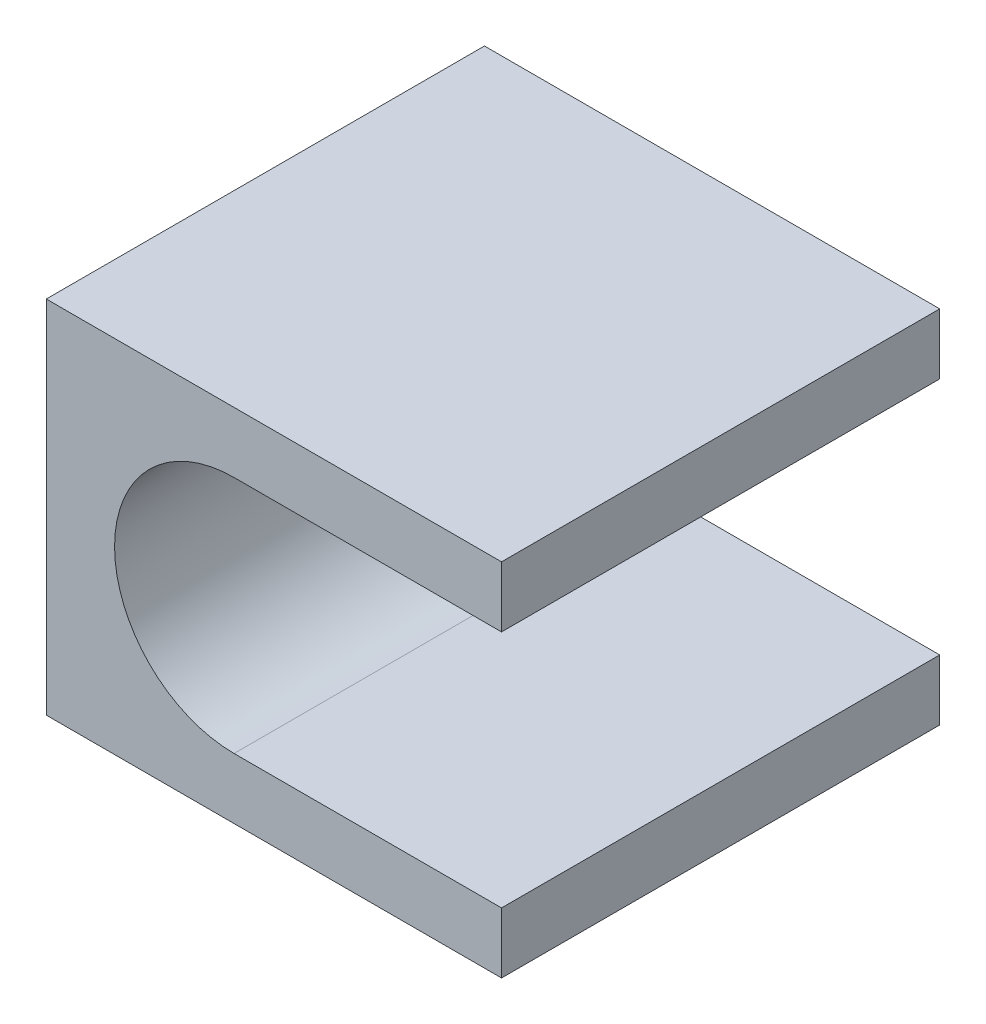
from build123d import *

# Parameters (mm, degrees)
SKETCH_1_24X19_W         = 19
SKETCH_1_24X19_H         = 24
EXTRUDE_1_33_DEPTH       = 33
CUT_EXTRUDE_2_REACH      = 38.377
CUT_EXTRUDE_4_2_DEPTH    = 1.9
CUT_EXTRUDE_6_3_REACH    = 29.71
SKETCH_7_5_W             = 24
SKETCH_7_5_H             = 19
EXTRUDE_7_DEPTH          = 5
CUT_EXTRUDE_10_4_REACH   = 41.925
SKETCH_11_W              = 8.5
SKETCH_11_H              = 3.1
CUT_EXTRUDE_11_5_DEPTH   = 4.9
SKETCH_11D1_W            = 6
SKETCH_11D1_H            = 3.1
CUT_EXTRUDE_11D1_6_DEPTH = 10
CUT_EXTRUDE_12_9_REACH   = 31.655
CUT_EXTRUDE_11_DEPTH     = 3.5
SKETCH_5903_W            = 53.98
SKETCH_5903_H            = 19
CUT_EXTRUDE_12_DEPTH     = 1
CUT_EXTRUDE_13_DEPTH     = 40.102429623
CUT_EXTRUDE_15_REACH     = 33.036
SKETCH_5021_R            = 3.5
EXTRUDE_2_DEPTH          = 0.4
SKETCH_7445_W            = 0.8
SKETCH_7445_H            = 3.1
EXTRUDE_3_DEPTH          = 19
CUT_EXTRUDE_16_DEPTH     = 32.036269144
SKETCH_14_W              = 24
SKETCH_14_H              = 19
CUT_EXTRUDE_19_DEPTH     = 28.710286942


with BuildPart() as part:
    # 1底部方形_24x19 → 1凸台-拉伸_高33 (new body)
    with BuildSketch(Plane(origin=(0, 0, 0), x_dir=(0, 1, 0), z_dir=(0, 0, 1))):
        Rectangle(SKETCH_1_24X19_W, SKETCH_1_24X19_H)
    extrude(amount=EXTRUDE_1_33_DEPTH)

    # 2吸嘴停靠渐变槽 → 2切除-拉伸 (cut, up to next)
    with BuildSketch(Plane.XY.offset(33), mode=Mode.PRIVATE) as cut_extrude_2_sk1:
        with BuildLine():
            Line((12, -5.1), (12, 5.1))
            Line((12, 5.1), (-1.9, 5.1))
            add(Edge.make_bspline(
                [(-5.213938048, 3.830222216), (-3.829124073, 5.093205317), (-1.9, 5.1)],
                knots=[0, 0, 0, 1, 1, 1], degree=2))
            ThreePointArc((-5.213938048, 3.830222216), (-7, 0), (-5.213938048, -3.830222216))
            add(Edge.make_bspline(
                [(-5.213938048, -3.830222216), (-3.829124073, -5.093205317), (-1.9, -5.1)],
                knots=[0, 0, 0, 1, 1, 1], degree=2))
            Line((-1.9, -5.1), (12, -5.1))
        make_face()
    cut_extrude_2_tool1 = extrude(cut_extrude_2_sk1.sketch, amount=-CUT_EXTRUDE_2_REACH, mode=Mode.PRIVATE) & part.part
    add(cut_extrude_2_tool1.solids().sort_by_distance((3.017719, 0, 33))[0], mode=Mode.SUBTRACT)

    # 4反光板停靠槽 → 4切除-拉伸2 (cut)
    with BuildSketch(Plane.XY.offset(25)):
        with BuildLine():
            Line((-0.7, 8.4), (12, 8.4))
            Line((12, 8.4), (12, -8.4))
            Line((12, -8.4), (-0.7, -8.4))
            ThreePointArc((-0.7, -8.4), (-10.5, 0), (-0.7, 8.4))
        make_face()
    extrude(amount=-CUT_EXTRUDE_4_2_DEPTH, mode=Mode.SUBTRACT)

    # 6反光板小圆柱 → 6切除-拉伸3 (cut, up to next)
    with BuildSketch(Plane.XY.offset(23.1), mode=Mode.PRIVATE) as cut_extrude_6_3_sk1:
        with BuildLine():
            Line((-2.1, -6.3), (12, -6.3))
            Line((12, -6.3), (12, 6.3))
            Line((12, 6.3), (-2.1, 6.3))
            ThreePointArc((-2.1, 6.3), (-8.4, 0), (-2.1, -6.3))
        make_face()
    cut_extrude_6_3_tool1 = extrude(cut_extrude_6_3_sk1.sketch, amount=-CUT_EXTRUDE_6_3_REACH, mode=Mode.PRIVATE) & part.part
    add(cut_extrude_6_3_tool1.solids().sort_by_distance((2.424095, 0, 23.1))[0], mode=Mode.SUBTRACT)

    # 7草图5 → 7凸台-拉伸_底板厚度 (add)
    with BuildSketch(Plane(origin=(0, 0, 0), x_dir=(1, 0, 0), z_dir=(0, 0, -1))):
        Rectangle(SKETCH_7_5_W, SKETCH_7_5_H)
    extrude(amount=-EXTRUDE_7_DEPTH)

    # 10切除-拉伸4: up to this face of the body (flat: up to its plane)
    cut_extrude_10_4_end = Plane(part.part.faces().sort_by_distance((0, -9.5, 16.5))[0])
    # Sketch 10 → 10切除-拉伸4 (cut, up to the picked face)
    with BuildSketch(Plane(origin=(0, 9.5, 0), x_dir=(-1, 0, 0), z_dir=(0, 1, 0)), mode=Mode.PRIVATE) as cut_extrude_10_4_sk1:
        Polygon((-12, 31.162738066), (-12, 33), (9, 33), align=None)
    cut_extrude_10_4_tool1 = split(extrude(cut_extrude_10_4_sk1.sketch, amount=-CUT_EXTRUDE_10_4_REACH, mode=Mode.PRIVATE), bisect_by=cut_extrude_10_4_end, keep=Keep.BOTH, mode=Mode.PRIVATE)
    add(cut_extrude_10_4_tool1.solids().sort_by(Axis((5, 9.5, 32.387579), (0, -1, 0)))[0], mode=Mode.SUBTRACT)

    # Sketch 11 → 11切除-拉伸5 (cut)
    with BuildSketch(Plane(origin=(-12, 0, 0), x_dir=(0, -1, 0), z_dir=(-1, 0, 0))):
        with Locations((-5.25, 26.95)):
            Rectangle(SKETCH_11_W, SKETCH_11_H)
        with Locations((5.25, 26.95)):
            Rectangle(SKETCH_11_W, SKETCH_11_H)
    extrude(amount=-CUT_EXTRUDE_11_5_DEPTH, mode=Mode.SUBTRACT)

    # 11d1_磁铁开窗 → 11d1切除-拉伸6 (cut)
    with BuildSketch(Plane(origin=(-12, 0, 0), x_dir=(0, -1, 0), z_dir=(-1, 0, 0))):
        with Locations((0, 26.95)):
            Rectangle(SKETCH_11D1_W, SKETCH_11D1_H)
    extrude(amount=-CUT_EXTRUDE_11D1_6_DEPTH, mode=Mode.SUBTRACT)

    # 12切除薄壁 → 12切除-拉伸9 (cut, up to next)
    with BuildSketch(Plane.XY.offset(25.4), mode=Mode.PRIVATE) as cut_extrude_12_9_sk1:
        with BuildLine():
            Line((-0.7, 8.4), (-0.7, -8.4))
            ThreePointArc((-0.7, -8.4), (-10.5, 0), (-0.7, 8.4))
        make_face()
    cut_extrude_12_9_tool1 = extrude(cut_extrude_12_9_sk1.sketch, amount=-CUT_EXTRUDE_12_9_REACH, mode=Mode.PRIVATE) & part.part
    add(cut_extrude_12_9_tool1.solids().sort_by_distance((-4.916056, 0, 25.4))[0], mode=Mode.SUBTRACT)

    # Sketch 5393 → 切除-拉伸11 (cut)
    with BuildSketch(Plane.XY.offset(33)):
        with BuildLine():
            Line((-2.099999748, 6.5), (12, 6.5))
            Line((12, 6.5), (12, -6.5))
            Line((12, -6.5), (-2.099999748, -6.5))
            ThreePointArc((-2.099999748, -6.5), (-8.6, 0), (-2.099999748, 6.5))
        make_face()
    extrude(amount=-CUT_EXTRUDE_11_DEPTH, mode=Mode.SUBTRACT)

    # Sketch 5903 → 切除-拉伸12 (cut)
    with BuildSketch(Plane.XY.offset(33)):
        with Locations((14.99, 0)):
            Rectangle(SKETCH_5903_W, SKETCH_5903_H)
    extrude(amount=-CUT_EXTRUDE_12_DEPTH, mode=Mode.SUBTRACT)

    # Sketch 6208 → 切除-拉伸13 (cut, through all)
    with BuildSketch(Plane.XZ.offset(9.5)):
        Polygon((2.430052303, 32), (12, 31.162738066), (12, 28.826114347), (-6, 32), align=None)
    extrude(amount=-CUT_EXTRUDE_13_DEPTH, mode=Mode.SUBTRACT)

    # Sketch 5021 → 切除-拉伸15 (cut, up to next)
    with BuildSketch(Plane.XY.offset(5), mode=Mode.PRIVATE) as cut_extrude_15_sk1:
        with Locations((2, 0)):
            Circle(SKETCH_5021_R)
    cut_extrude_15_tool1 = extrude(cut_extrude_15_sk1.sketch, amount=-CUT_EXTRUDE_15_REACH, mode=Mode.PRIVATE) & part.part
    add(cut_extrude_15_tool1.solids().sort_by_distance((2, 0, 5))[0], mode=Mode.SUBTRACT)

    # Sketch 6983 → 凸台-拉伸2 (add)
    with BuildSketch(Plane(origin=(0, 0, 25.4), x_dir=(1, 0, 0), z_dir=(0, 0, -1))):
        with BuildLine():
            Line((-7.1, -3), (-7.1, -6.8))
            ThreePointArc((-7.1, -6.8), (-4.061552813, -8.246211251), (-0.7, -8.4))
            Line((-0.7, -8.4), (-0.7, -5.1))
            Line((-0.7, -5.1), (-1.9, -5.1))
            add(Edge.make_bspline(
                [(-1.9, -5.1), (-3.829124073, -5.093205317), (-5.213938048, -3.830222216)],
                knots=[0, 0, 0, 1, 1, 1], degree=2))
            ThreePointArc((-5.213938048, -3.830222216), (-5.630777158, -3.437652866), (-6, -3))
            Line((-6, -3), (-7.1, -3))
        make_face()
        with BuildLine():
            Line((-7.1, 3), (-6, 3))
            ThreePointArc((-6, 3), (-5.630777158, 3.437652866), (-5.213938048, 3.830222216))
            add(Edge.make_bspline(
                [(-5.213938048, 3.830222216), (-3.829124073, 5.093205317), (-1.9, 5.1)],
                knots=[0, 0, 0, 1, 1, 1], degree=2))
            Line((-1.9, 5.1), (-0.7, 5.1))
            Line((-0.7, 5.1), (-0.7, 8.4))
            ThreePointArc((-0.7, 8.4), (-4.061552813, 8.246211251), (-7.1, 6.8))
            Line((-7.1, 6.8), (-7.1, 3))
        make_face()
    extrude(amount=EXTRUDE_2_DEPTH)

    # Sketch 7445 → 凸台-拉伸3 (add)
    with BuildSketch(Plane.XZ.offset(9.5)):
        with Locations((-11.6, 26.95)):
            Rectangle(SKETCH_7445_W, SKETCH_7445_H)
    extrude(amount=-EXTRUDE_3_DEPTH)

    # 草图13 → 切除-拉伸16 (cut, through all)
    with BuildSketch(Plane.XY.offset(5)):
        with BuildLine():
            Line((-2.1, -6.3), (12, -6.3))
            Line((12, -6.3), (12, 6.3))
            Line((12, 6.3), (-2.1, 6.3))
            ThreePointArc((-2.1, 6.3), (-8.4, 0), (-2.1, -6.3))
        make_face()
    extrude(amount=-CUT_EXTRUDE_16_DEPTH, mode=Mode.SUBTRACT)

    # 草图14 → 切除-拉伸19 (cut, through all)
    with BuildSketch(Plane.XY.offset(23.1)):
        Rectangle(SKETCH_14_W, SKETCH_14_H)
    extrude(amount=CUT_EXTRUDE_19_DEPTH, mode=Mode.SUBTRACT)


solid = part.part
